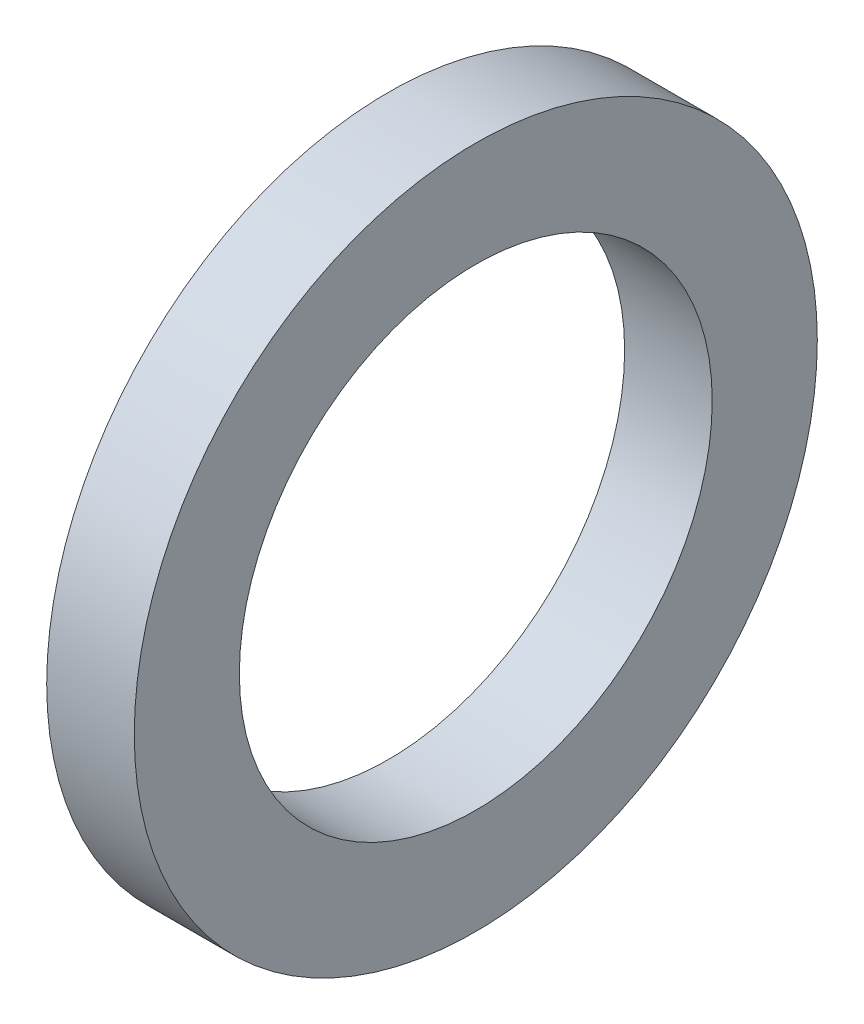
from build123d import *

# Parameters (mm, degrees)
SKETCH1_W = 5
SKETCH1_H = 6


with BuildPart() as part:
    # Sketch1 → Base-Revolve (revolve)
    with BuildSketch(Plane.XY, mode=Mode.PRIVATE) as base_revolve_sk:
        with Locations((-2.5, 16.5)):
            Rectangle(SKETCH1_W, SKETCH1_H)
    revolve(base_revolve_sk.sketch.rotate(Axis((-34.925, 0, 0), (1, 0, 0)), 90), axis=Axis((-34.925, 0, 0), (1, 0, 0)))


solid = part.part
